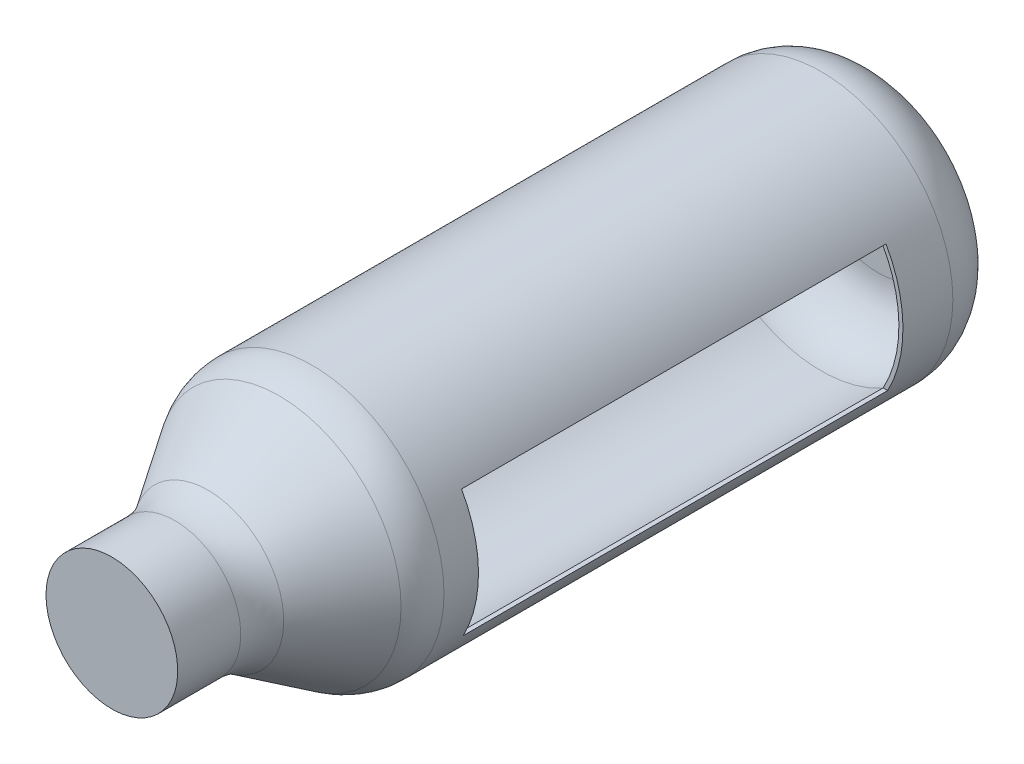
from build123d import *

# Parameters (mm, degrees)
SKETCH2_W          = 31.114715918
SKETCH2_H          = 104.73171331
CUT_EXTRUDE1_DEPTH = 48


with BuildPart() as part:
    # Sketch1 → Revolve1 (revolve)
    with BuildSketch(Plane.YZ, mode=Mode.PRIVATE) as revolve1_sk:
        with BuildLine():
            Line((0, 0), (17.5, 0))
            ThreePointArc((17.5, 0), (28.106601718, 4.393398282), (32.5, 15))
            Line((32.5, 15), (32.5, 140.55339898))
            ThreePointArc((32.5, 140.55339898), (31.881408374, 144.816624656), (30.076654245, 148.728224239))
            Line((30.076654245, 148.728224239), (18.673345755, 166.271775761))
            ThreePointArc((18.673345755, 166.271775761), (16.868591626, 170.183375344), (16.25, 174.44660102))
            Line((16.25, 174.44660102), (16.25, 190))
            Line((16.25, 190), (0, 190))
            Line((0, 190), (0, 189))
            Line((0, 189), (15.25, 189))
            Line((15.25, 189), (15.25, 174.44660102))
            ThreePointArc((15.25, 174.44660102), (15.909831067, 169.899160298), (17.834902139, 165.72678741))
            Line((17.834902139, 165.72678741), (29.238210628, 148.183235889))
            ThreePointArc((29.238210628, 148.183235889), (30.922647816, 144.532409611), (31.5, 140.55339898))
            Line((31.5, 140.55339898), (31.5, 15))
            ThreePointArc((31.5, 15), (27.399494937, 5.100505063), (17.5, 1))
            Line((17.5, 1), (0, 1))
            Line((0, 1), (0, 0))
        make_face()
    revolve(revolve1_sk.sketch.rotate(Axis((0, 0, 0), (0, 0, 1)), 90), axis=Axis((0, 0, 0), (0, 0, 1)))

    # Sketch2 → Cut-Extrude1 (cut)
    with BuildSketch(Plane.YZ.offset(60)):
        with Locations((0.396690762, 79.674592023)):
            Rectangle(SKETCH2_W, SKETCH2_H)
    extrude(amount=-CUT_EXTRUDE1_DEPTH, mode=Mode.SUBTRACT)


solid = part.part
